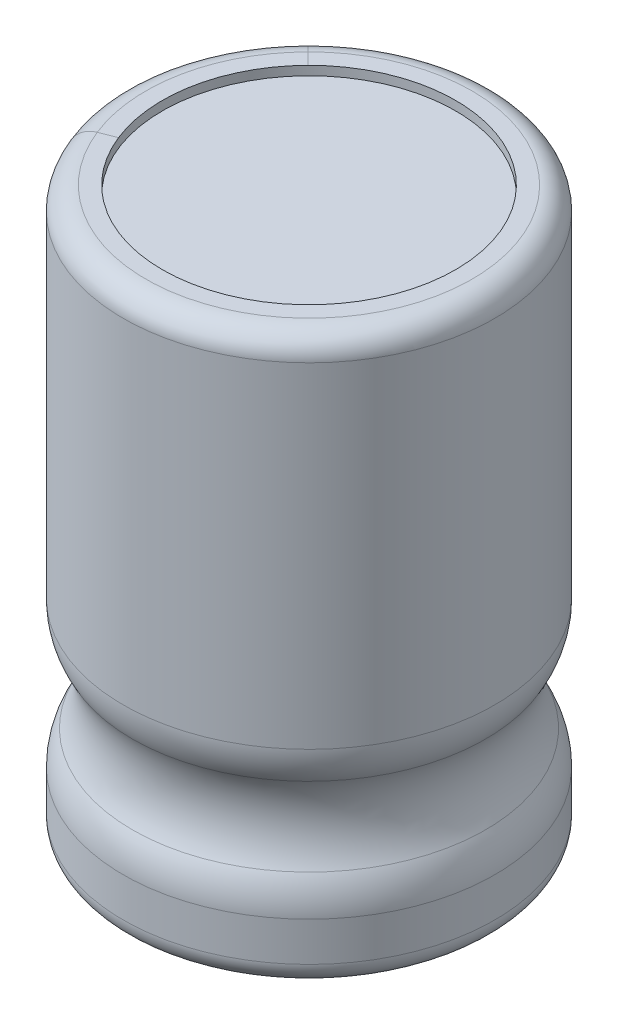
from build123d import *

# Parameters (mm, degrees)
CROQUIS1_R            = 4.1
EXTRUIR1_DEPTH        = 12.5
CROQUIS2_R            = 1.721107575
REDONDEO1_R           = 0.5
REDONDEO2_R           = 1.5
CROQUIS3_R            = 3.23696878
CORTAR_EXTRUIR1_DEPTH = 0.2


with BuildPart() as part:
    # Croquis1 → Extruir1 (new body)
    with BuildSketch(Plane(origin=(0, 0, 0), x_dir=(1, 0, 0), z_dir=(0, 1, 0))):
        with Locations(Location((0, 0, 0), (0, 0, 270))):
            Circle(CROQUIS1_R)
    extrude(amount=EXTRUIR1_DEPTH)

    # Croquis2 → Cortar-Revolución1 (revolve, cut)
    with BuildSketch(Plane(origin=(0, 0, 0), x_dir=(0, 0, -1), z_dir=(1, 0, 0))):
        with Locations((5.382002142, 2.987795872)):
            Circle(CROQUIS2_R)
    revolve(axis=Axis((0, 12.5, 0), (0, 1, 0)), mode=Mode.SUBTRACT)

    # Redondeo1
    redondeo1_edges = [part.edges().sort_by_distance(p)[0] for p in [
        (0, 0, -4.1),
        (0, 12.5, -4.1),
    ]]
    fillet(redondeo1_edges, radius=REDONDEO1_R)

    # Redondeo2
    redondeo2_edges = [part.edges().sort_by_distance(p)[0] for p in [
        (4.1, 4.136134582, 0),
        (-4.1, 1.839457161, 0),
    ]]
    fillet(redondeo2_edges, radius=REDONDEO2_R)

    # Croquis3 → Cortar-Extruir1 (cut)
    with BuildSketch(Plane(origin=(0, 12.5, 0), x_dir=(1, 0, 0), z_dir=(0, 1, 0))):
        with Locations(Location((0, 0, 0), (0, 0, 270))):
            Circle(CROQUIS3_R)
    extrude(amount=-CORTAR_EXTRUIR1_DEPTH, mode=Mode.SUBTRACT)


solid = part.part
